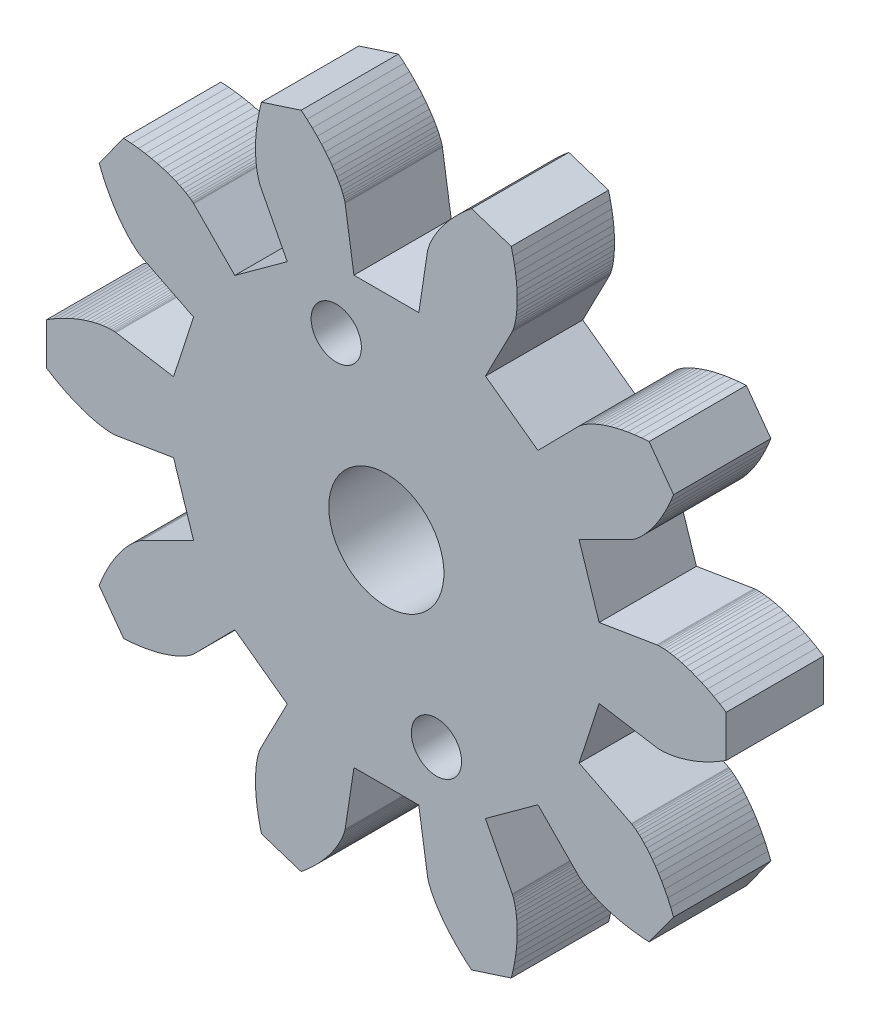
from build123d import *

# Parameters (mm, degrees)
BOSS_EXTRUDE1_DEPTH = 6
SKETCH3_R           = 1.55
CUT_EXTRUDE2_DEPTH  = 30.811811325
SKETCH8_R           = 3.55
CUT_EXTRUDE4_DEPTH  = 30.811811325
CIRPATTERN1_COUNT   = 2


with BuildPart() as part:
    # Model → Boss-Extrude1 (new body)
    with BuildSketch(Plane.XY):
        Polygon((13.123211873, 2.161321388), (16.6790122, 2.746942299), (16.691613751, 2.748684274), (16.729575407, 2.75260353), (16.793046957, 2.756731367), (16.882063506, 2.75909222), (16.996545232, 2.757709602), (17.136297418, 2.75061204), (17.301010784, 2.735839019), (17.490262098, 2.711446898), (17.70351508, 2.675514791), (17.940121583, 2.626150408), (18.199323066, 2.561495829), (18.480252338, 2.479733213), (18.781935582, 2.379090411), (19.103294651, 2.257846486), (19.443149627, 2.114337127), (19.80022165, 1.946959926), (20.17313599, 1.754179531), (20.560425385, 1.534532644), (20.960533606, 1.286632864), (20.960533606, -1.286632864), (20.560425385, -1.534532644), (20.17313599, -1.754179531), (19.80022165, -1.946959926), (19.443149627, -2.114337127), (19.103294651, -2.257846486), (18.781935582, -2.379090411), (18.480252338, -2.479733213), (18.199323066, -2.561495829), (17.940121583, -2.626150408), (17.70351508, -2.675514791), (17.490262098, -2.711446898), (17.301010784, -2.735839019), (17.136297418, -2.75061204), (16.996545232, -2.757709602), (16.882063506, -2.75909222), (16.793046957, -2.756731367), (16.729575407, -2.75260353), (16.691613751, -2.748684274), (16.6790122, -2.746942299), (13.123211873, -2.161321388), (11.887294263, -5.965084669), (15.108216491, -7.581354391), (15.119435267, -7.58735211), (15.152450573, -7.606494667), (15.206226417, -7.640462818), (15.279629993, -7.690875462), (15.371434972, -7.759284694), (15.480325023, -7.847171016), (15.604897572, -7.955938728), (15.743667772, -8.086911501), (15.895072696, -8.241328143), (16.057475722, -8.420338581), (16.229171119, -8.625000043), (16.408388814, -8.856273472), (16.593299331, -9.115020171), (16.782018888, -9.401998688), (16.972614654, -9.717861942), (17.163110138, -10.06315461), (17.351490704, -10.438310776), (17.535709206, -10.843651835), (17.713691721, -11.279384681), (16.201164076, -13.361200387), (15.731757891, -13.32657781), (15.289328988, -13.276632879), (14.874321476, -13.213401945), (14.487062291, -13.138931277), (14.127761155, -13.055271044), (13.796510816, -12.964469318), (13.49328759, -12.868566094), (13.217952174, -12.769587357), (12.970250762, -12.6695392), (12.749816424, -12.570402012), (12.556170775, -12.47412474), (12.388725916, -12.382619249), (12.24678664, -12.297754786), (12.129552904, -12.221352561), (12.03612256, -12.155180452), (11.965494333, -12.100947867), (11.916571053, -12.060300736), (11.888163109, -12.034816689), (11.878992147, -12.026000396), (9.346508589, -9.462176135), (6.110834279, -11.813031127), (7.766595593, -15.013831385), (7.772146402, -15.025277872), (7.787604633, -15.060170436), (7.811144227, -15.119259895), (7.840897159, -15.203190121), (7.874959009, -15.312495965), (7.911394627, -15.447601459), (7.948243879, -15.608818294), (7.983527465, -15.79634457), (8.015252796, -16.010263839), (8.041419908, -16.250544429), (8.060027414, -16.517039052), (8.069078464, -16.809484705), (8.06658672, -17.127502856), (8.050582309, -17.470599926), (8.019117761, -17.838168046), (7.970273907, -18.22948612), (7.902165724, -18.643721152), (7.812948126, -19.079929875), (7.700821665, -19.537060651), (5.253500526, -20.332243492), (4.894093585, -20.028323206), (4.565517978, -19.727863724), (4.266936058, -19.432773529), (3.997409557, -19.144900255), (3.755903082, -18.866025795), (3.541287844, -18.597861592), (3.352345602, -18.342044113), (3.187772814, -18.100130537), (3.046184993, -17.873594641), (2.926121244, -17.663822917), (2.826048984, -17.472110911), (2.744368826, -17.299659795), (2.679419619, -17.14757319), (2.629483635, -17.01685423), (2.592791888, -16.908402891), (2.567529567, -16.823013578), (2.551841586, -16.761372975), (2.543838223, -16.724058178), (2.541600846, -16.711535091), (1.9997567, -13.148801205), (-1.9997567, -13.148801205), (-2.541600846, -16.711535091), (-2.543838223, -16.724058178), (-2.551841586, -16.761372975), (-2.567529567, -16.823013578), (-2.592791888, -16.908402891), (-2.629483635, -17.01685423), (-2.679419619, -17.14757319), (-2.744368826, -17.299659795), (-2.826048984, -17.472110911), (-2.926121244, -17.663822917), (-3.046184993, -17.873594641), (-3.187772814, -18.100130537), (-3.352345602, -18.342044113), (-3.541287844, -18.597861592), (-3.755903082, -18.866025795), (-3.997409557, -19.144900255), (-4.266936058, -19.432773529), (-4.565517978, -19.727863724), (-4.894093585, -20.028323206), (-5.253500526, -20.332243492), (-7.700821665, -19.537060651), (-7.812948126, -19.079929875), (-7.902165724, -18.643721152), (-7.970273907, -18.22948612), (-8.019117761, -17.838168046), (-8.050582309, -17.470599926), (-8.06658672, -17.127502856), (-8.069078464, -16.809484705), (-8.060027414, -16.517039052), (-8.041419908, -16.250544429), (-8.015252796, -16.010263839), (-7.983527465, -15.79634457), (-7.948243879, -15.608818294), (-7.911394627, -15.447601459), (-7.874959009, -15.312495965), (-7.840897159, -15.203190121), (-7.811144227, -15.119259895), (-7.787604633, -15.060170436), (-7.772146402, -15.025277872), (-7.766595593, -15.013831385), (-6.110834279, -11.813031127), (-9.346508589, -9.462176135), (-11.878992147, -12.026000396), (-11.888163109, -12.034816689), (-11.916571053, -12.060300736), (-11.965494333, -12.100947867), (-12.03612256, -12.155180452), (-12.129552904, -12.221352561), (-12.24678664, -12.297754786), (-12.388725916, -12.382619249), (-12.556170775, -12.47412474), (-12.749816424, -12.570402012), (-12.970250762, -12.6695392), (-13.217952174, -12.769587357), (-13.49328759, -12.868566094), (-13.796510816, -12.964469318), (-14.127761155, -13.055271044), (-14.487062291, -13.138931277), (-14.874321476, -13.213401945), (-15.289328988, -13.276632879), (-15.731757891, -13.32657781), (-16.201164076, -13.361200387), (-17.713691721, -11.279384681), (-17.535709206, -10.843651835), (-17.351490704, -10.438310776), (-17.163110138, -10.06315461), (-16.972614654, -9.717861942), (-16.782018888, -9.401998688), (-16.593299331, -9.115020171), (-16.408388814, -8.856273472), (-16.229171119, -8.625000043), (-16.057475722, -8.420338581), (-15.895072696, -8.241328143), (-15.743667772, -8.086911501), (-15.604897572, -7.955938728), (-15.480325023, -7.847171016), (-15.371434972, -7.759284694), (-15.279629993, -7.690875462), (-15.206226417, -7.640462818), (-15.152450573, -7.606494667), (-15.119435267, -7.58735211), (-15.108216491, -7.581354391), (-11.887294263, -5.965084669), (-13.123211873, -2.161321388), (-16.6790122, -2.746942299), (-16.691613751, -2.748684274), (-16.729575407, -2.75260353), (-16.793046957, -2.756731367), (-16.882063506, -2.75909222), (-16.996545232, -2.757709602), (-17.136297418, -2.75061204), (-17.301010784, -2.735839019), (-17.490262098, -2.711446898), (-17.70351508, -2.675514791), (-17.940121583, -2.626150408), (-18.199323066, -2.561495829), (-18.480252338, -2.479733213), (-18.781935582, -2.379090411), (-19.103294651, -2.257846486), (-19.443149627, -2.114337127), (-19.80022165, -1.946959926), (-20.17313599, -1.754179531), (-20.560425385, -1.534532644), (-20.960533606, -1.286632864), (-20.960533606, 1.286632864), (-20.560425385, 1.534532644), (-20.17313599, 1.754179531), (-19.80022165, 1.946959926), (-19.443149627, 2.114337127), (-19.103294651, 2.257846486), (-18.781935582, 2.379090411), (-18.480252338, 2.479733213), (-18.199323066, 2.561495829), (-17.940121583, 2.626150408), (-17.70351508, 2.675514791), (-17.490262098, 2.711446898), (-17.301010784, 2.735839019), (-17.136297418, 2.75061204), (-16.996545232, 2.757709602), (-16.882063506, 2.75909222), (-16.793046957, 2.756731367), (-16.729575407, 2.75260353), (-16.691613751, 2.748684274), (-16.6790122, 2.746942299), (-13.123211873, 2.161321388), (-11.887294263, 5.965084669), (-15.108216491, 7.581354391), (-15.119435267, 7.58735211), (-15.152450573, 7.606494667), (-15.206226417, 7.640462818), (-15.279629993, 7.690875462), (-15.371434972, 7.759284694), (-15.480325023, 7.847171016), (-15.604897572, 7.955938728), (-15.743667772, 8.086911501), (-15.895072696, 8.241328143), (-16.057475722, 8.420338581), (-16.229171119, 8.625000043), (-16.408388814, 8.856273472), (-16.593299331, 9.115020171), (-16.782018888, 9.401998688), (-16.972614654, 9.717861942), (-17.163110138, 10.06315461), (-17.351490704, 10.438310776), (-17.535709206, 10.843651835), (-17.713691721, 11.279384681), (-16.201164076, 13.361200387), (-15.731757891, 13.32657781), (-15.289328988, 13.276632879), (-14.874321476, 13.213401945), (-14.487062291, 13.138931277), (-14.127761155, 13.055271044), (-13.796510816, 12.964469318), (-13.49328759, 12.868566094), (-13.217952174, 12.769587357), (-12.970250762, 12.6695392), (-12.749816424, 12.570402012), (-12.556170775, 12.47412474), (-12.388725916, 12.382619249), (-12.24678664, 12.297754786), (-12.129552904, 12.221352561), (-12.03612256, 12.155180452), (-11.965494333, 12.100947867), (-11.916571053, 12.060300736), (-11.888163109, 12.034816689), (-11.878992147, 12.026000396), (-9.346508589, 9.462176135), (-6.110834279, 11.813031127), (-7.766595593, 15.013831385), (-7.772146402, 15.025277872), (-7.787604633, 15.060170436), (-7.811144227, 15.119259895), (-7.840897159, 15.203190121), (-7.874959009, 15.312495965), (-7.911394627, 15.447601459), (-7.948243879, 15.608818294), (-7.983527465, 15.79634457), (-8.015252796, 16.010263839), (-8.041419908, 16.250544429), (-8.060027414, 16.517039052), (-8.069078464, 16.809484705), (-8.06658672, 17.127502856), (-8.050582309, 17.470599926), (-8.019117761, 17.838168046), (-7.970273907, 18.22948612), (-7.902165724, 18.643721152), (-7.812948126, 19.079929875), (-7.700821665, 19.537060651), (-5.253500526, 20.332243492), (-4.894093585, 20.028323206), (-4.565517978, 19.727863724), (-4.266936058, 19.432773529), (-3.997409557, 19.144900255), (-3.755903082, 18.866025795), (-3.541287844, 18.597861592), (-3.352345602, 18.342044113), (-3.187772814, 18.100130537), (-3.046184993, 17.873594641), (-2.926121244, 17.663822917), (-2.826048984, 17.472110911), (-2.744368826, 17.299659795), (-2.679419619, 17.14757319), (-2.629483635, 17.01685423), (-2.592791888, 16.908402891), (-2.567529567, 16.823013578), (-2.551841586, 16.761372975), (-2.543838223, 16.724058178), (-2.541600846, 16.711535091), (-1.9997567, 13.148801205), (1.9997567, 13.148801205), (2.541600846, 16.711535091), (2.543838223, 16.724058178), (2.551841586, 16.761372975), (2.567529567, 16.823013578), (2.592791888, 16.908402891), (2.629483635, 17.01685423), (2.679419619, 17.14757319), (2.744368826, 17.299659795), (2.826048984, 17.472110911), (2.926121244, 17.663822917), (3.046184993, 17.873594641), (3.187772814, 18.100130537), (3.352345602, 18.342044113), (3.541287844, 18.597861592), (3.755903082, 18.866025795), (3.997409557, 19.144900255), (4.266936058, 19.432773529), (4.565517978, 19.727863724), (4.894093585, 20.028323206), (5.253500526, 20.332243492), (7.700821665, 19.537060651), (7.812948126, 19.079929875), (7.902165724, 18.643721152), (7.970273907, 18.22948612), (8.019117761, 17.838168046), (8.050582309, 17.470599926), (8.06658672, 17.127502856), (8.069078464, 16.809484705), (8.060027414, 16.517039052), (8.041419908, 16.250544429), (8.015252796, 16.010263839), (7.983527465, 15.79634457), (7.948243879, 15.608818294), (7.911394627, 15.447601459), (7.874959009, 15.312495965), (7.840897159, 15.203190121), (7.811144227, 15.119259895), (7.787604633, 15.060170436), (7.772146402, 15.025277872), (7.766595593, 15.013831385), (6.110834279, 11.813031127), (9.346508589, 9.462176135), (11.878992147, 12.026000396), (11.888163109, 12.034816689), (11.916571053, 12.060300736), (11.965494333, 12.100947867), (12.03612256, 12.155180452), (12.129552904, 12.221352561), (12.24678664, 12.297754786), (12.388725916, 12.382619249), (12.556170775, 12.47412474), (12.749816424, 12.570402012), (12.970250762, 12.6695392), (13.217952174, 12.769587357), (13.49328759, 12.868566094), (13.796510816, 12.964469318), (14.127761155, 13.055271044), (14.487062291, 13.138931277), (14.874321476, 13.213401945), (15.289328988, 13.276632879), (15.731757891, 13.32657781), (16.201164076, 13.361200387), (17.713691721, 11.279384681), (17.535709206, 10.843651835), (17.351490704, 10.438310776), (17.163110138, 10.06315461), (16.972614654, 9.717861942), (16.782018888, 9.401998688), (16.593299331, 9.115020171), (16.408388814, 8.856273472), (16.229171119, 8.625000043), (16.057475722, 8.420338581), (15.895072696, 8.241328143), (15.743667772, 8.086911501), (15.604897572, 7.955938728), (15.480325023, 7.847171016), (15.371434972, 7.759284694), (15.279629993, 7.690875462), (15.206226417, 7.640462818), (15.152450573, 7.606494667), (15.119435267, 7.58735211), (15.108216491, 7.581354391), (11.887294263, 5.965084669), align=None)
    extrude(amount=BOSS_EXTRUDE1_DEPTH)

    # Sketch3 → Cut-Extrude2 (cut, through all)
    with BuildSketch(Plane.XY.offset(6)):
        with Locations((-3.090169944, 9.510565163)):
            Circle(SKETCH3_R)
    cut_extrude2 = extrude(amount=-CUT_EXTRUDE2_DEPTH, mode=Mode.SUBTRACT)

    # Sketch8 → Cut-Extrude4 (cut, through all)
    with BuildSketch(Plane(origin=(0, 0, 0), x_dir=(-1, 0, 0), z_dir=(0, 0, -1))):
        Circle(SKETCH8_R)
    extrude(amount=-CUT_EXTRUDE4_DEPTH, mode=Mode.SUBTRACT)

    # CirPattern1: Cut-Extrude2 ×2 about axis
    cirpattern1_axis = Axis((0, 0, 0), (0, 0, 1))
    for i in range(1, CIRPATTERN1_COUNT):
        add(cut_extrude2.rotate(cirpattern1_axis, i * 360 / CIRPATTERN1_COUNT), mode=Mode.SUBTRACT)


solid = part.part
